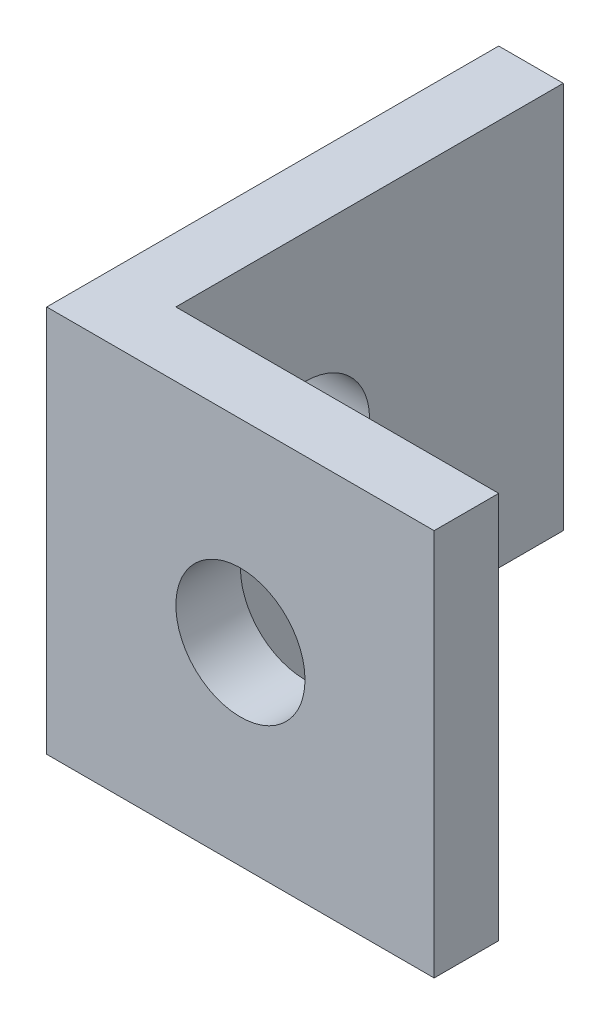
from build123d import *

# Parameters (mm, degrees)
CROQUIS1_W              = 5
CROQUIS1_H              = 30
CROQUIS1_W_2            = 30
CROQUIS1_H_2            = 5
SALIENTE_EXTRUIR1_DEPTH = 30
CROQUIS2_R              = 5
CORTAR_EXTRUIR1_DEPTH   = 5
CROQUIS3_R              = 5
CORTAR_EXTRUIR2_DEPTH   = 5


with BuildPart() as part:
    # Croquis1 → Saliente-Extruir1 (new body)
    with BuildSketch(Plane(origin=(0, 0, 0), x_dir=(1, 0, 0), z_dir=(0, 1, 0))):
        with Locations((-12.5, 17.5)):
            Rectangle(CROQUIS1_W, CROQUIS1_H)
        Rectangle(CROQUIS1_W_2, CROQUIS1_H_2)
    extrude(amount=SALIENTE_EXTRUIR1_DEPTH)

    # Croquis2 → Cortar-Extruir1 (cut)
    with BuildSketch(Plane.XY.offset(2.5)):
        with Locations((0, 15)):
            Circle(CROQUIS2_R)
    extrude(amount=-CORTAR_EXTRUIR1_DEPTH, mode=Mode.SUBTRACT)

    # Croquis3 → Cortar-Extruir2 (cut)
    with BuildSketch(Plane.ZY.offset(15)):
        with Locations((-12.5, 15)):
            Circle(CROQUIS3_R)
    extrude(amount=-CORTAR_EXTRUIR2_DEPTH, mode=Mode.SUBTRACT)


solid = part.part
